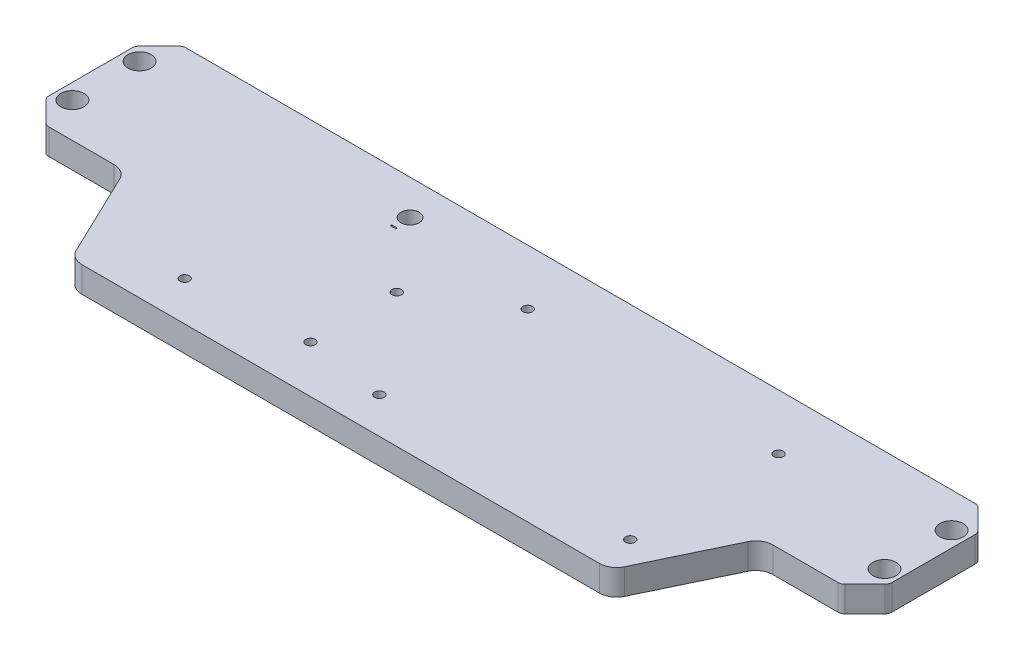
from build123d import *

# Parameters (mm, degrees)
SKETCH1_R           = 1.75
SKETCH1_R_2         = 4.318
SKETCH1_W           = 2.032
SKETCH1_H           = 0.508
SKETCH1_R_3         = 3.4
BOSS_EXTRUDE1_DEPTH = 9.525
FILLET1_R           = 6.35
CHAMFER1_SIZE       = 8.89
FILLET2_R           = 2.54


with BuildPart() as part:
    # Sketch1 → Boss-Extrude1 (new body)
    with BuildSketch(Plane(origin=(0, 0, 0), x_dir=(1, 0, 0), z_dir=(0, 1, 0))):
        Polygon((-156.2525, 25.4), (-156.2525, -25.4), (-118.1525, -25.4), (-99.913840717, -63.5), (99.913840717, -63.5), (118.1525, -25.4), (156.2525, -25.4), (156.2525, 25.4), align=None)
        with Locations(Location((-72.438538283, -48.905859703, 0), (0, 0, 90))):
            Circle(SKETCH1_R, mode=Mode.SUBTRACT)
        with Locations(Location((-28.750538283, -45.984859703, 0), (0, 0, 90))):
            Circle(SKETCH1_R, mode=Mode.SUBTRACT)
        with Locations(Location((-150.5375, -12.446, 0), (0, 0, 90))):
            Circle(SKETCH1_R_2, mode=Mode.SUBTRACT)
        with Locations(Location((-28.750538283, -13.980859703, 0), (0, 0, 90))):
            Circle(SKETCH1_R, mode=Mode.SUBTRACT)
        with Locations(Location((93.949510286, 4.876851367, 0), (0, 0, 90))):
            Circle(SKETCH1_R, mode=Mode.SUBTRACT)
        with Locations(Location((0.949510286, 4.876851367, 0), (0, 0, 90))):
            Circle(SKETCH1_R, mode=Mode.SUBTRACT)
        with Locations(Location((0.949510286, -50.123148633, 0), (0, 0, 90))):
            Circle(SKETCH1_R, mode=Mode.SUBTRACT)
        with Locations(Location((93.949510286, -50.123148633, 0), (0, 0, 90))):
            Circle(SKETCH1_R, mode=Mode.SUBTRACT)
        with Locations(Location((150.5375, -12.446, 0), (0, 0, 90))):
            Circle(SKETCH1_R_2, mode=Mode.SUBTRACT)
        with Locations(Location((-150.5375, 12.446, 0), (0, 0, 90))):
            Circle(SKETCH1_R_2, mode=Mode.SUBTRACT)
        with Locations((-50.250952403, 6.442)):
            Rectangle(SKETCH1_W, SKETCH1_H, mode=Mode.SUBTRACT)
        with Locations(Location((-50.250952403, 12.446, 0), (0, 0, 90))):
            Circle(SKETCH1_R_3, mode=Mode.SUBTRACT)
        with Locations(Location((150.5375, 12.446, 0), (0, 0, 90))):
            Circle(SKETCH1_R_2, mode=Mode.SUBTRACT)
    extrude(amount=BOSS_EXTRUDE1_DEPTH)

    # Fillet1
    fillet1_edges = [part.edges().sort_by_distance(p)[0] for p in [
        (118.1525, 4.7625, 25.4),
        (99.913840717, 4.7625, 63.5),
        (-99.913840717, 4.7625, 63.5),
        (-118.1525, 4.7625, 25.4),
    ]]
    fillet(fillet1_edges, radius=FILLET1_R)

    # Chamfer1
    chamfer1_edges = [part.edges().sort_by_distance(p)[0] for p in [
        (156.2525, 4.7625, -25.4),
        (156.2525, 4.7625, 25.4),
        (-156.2525, 4.7625, 25.4),
        (-156.2525, 4.7625, -25.4),
    ]]
    chamfer(chamfer1_edges, length=CHAMFER1_SIZE)

    # Fillet2
    fillet2_edges = [part.edges().sort_by_distance(p)[0] for p in [
        (-156.2525, 4.7625, 16.51),
        (-156.2525, 4.7625, -16.51),
        (147.3625, 4.7625, -25.4),
        (-147.3625, 4.7625, -25.4),
        (-147.3625, 4.7625, 25.4),
        (156.2525, 4.7625, 16.51),
        (156.2525, 4.7625, -16.51),
        (147.3625, 4.7625, 25.4),
    ]]
    fillet(fillet2_edges, radius=FILLET2_R)


solid = part.part
